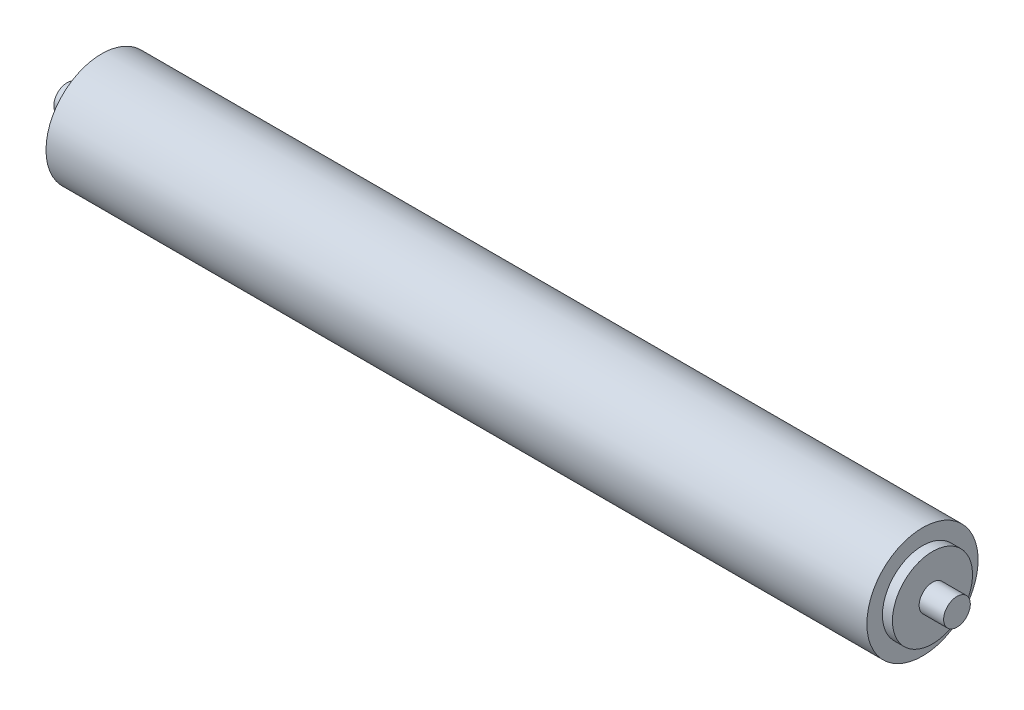
from build123d import *


with BuildPart() as part:
    # 草图1 → 旋转1 (revolve)
    with BuildSketch(Plane.XY, mode=Mode.PRIVATE) as revolve_1_sk:
        Polygon((0, 0), (400, 0), (400, 6), (389, 6), (389, 18), (384.5, 18), (384.5, 25), (15.5, 25), (15.5, 18), (11, 18), (11, 6), (0, 6), align=None)
    revolve(revolve_1_sk.sketch.rotate(Axis((0, 0, 0), (1, 0, 0)), 90), axis=Axis((0, 0, 0), (1, 0, 0)))


solid = part.part
